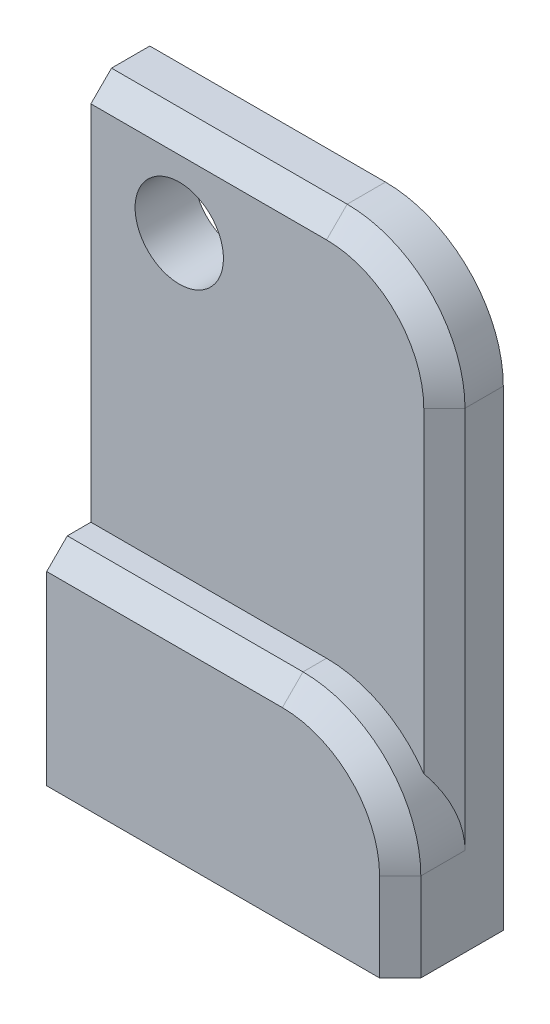
from build123d import *

# Parameters (mm, degrees)
SKETCH1_W           = 120
SKETCH1_H           = 200
BOSS_EXTRUDE1_DEPTH = 20
SKETCH2_W           = 120
SKETCH2_H           = 70
BOSS_EXTRUDE2_DEPTH = 15
SKETCH3_R           = 15
CUT_EXTRUDE1_DEPTH  = 119.321595662
FILLET1_R           = 40
CHAMFER1_SIZE       = 7
SHELL2_T            = -5


with BuildPart() as part:
    # Sketch1 → Boss-Extrude1 (new body)
    with BuildSketch(Plane.XY):
        Rectangle(SKETCH1_W, SKETCH1_H)
    extrude(amount=BOSS_EXTRUDE1_DEPTH)

    # Sketch2 → Boss-Extrude2 (add)
    with BuildSketch(Plane.XY.offset(20)):
        with Locations((0, -65)):
            Rectangle(SKETCH2_W, SKETCH2_H)
    extrude(amount=BOSS_EXTRUDE2_DEPTH)

    # Sketch3 → Cut-Extrude1 (cut, through all)
    with BuildSketch(Plane.XY.offset(20)):
        with Locations((-30, 70)):
            Circle(SKETCH3_R)
    extrude(amount=-CUT_EXTRUDE1_DEPTH, mode=Mode.SUBTRACT)

    # Fillet1
    fillet1_edges = [part.edges().sort_by_distance(p)[0] for p in [
        (60, -30, 27.5),
        (60, 100, 10),
    ]]
    fillet(fillet1_edges, radius=FILLET1_R)

    # Chamfer1
    chamfer1_edges = [part.edges().sort_by_distance(p)[0] for p in [
        (60, -5, 20),
        (60, -85, 35),
        (-20, -30, 35),
        (48.284271247, -41.715728753, 35),
        (-20, 100, 20),
        (48.284271247, 88.284271247, 20),
    ]]
    chamfer(chamfer1_edges, length=CHAMFER1_SIZE)

    # Shell2
    shell2_openings = [part.faces().sort_by_distance(p)[0] for p in [
        (0.159993916, -3.518488273, 0),
        (-0.338362671, -100, 17.411008662),
    ]]
    offset(amount=SHELL2_T, openings=shell2_openings, kind=Kind.INTERSECTION)


solid = part.part
